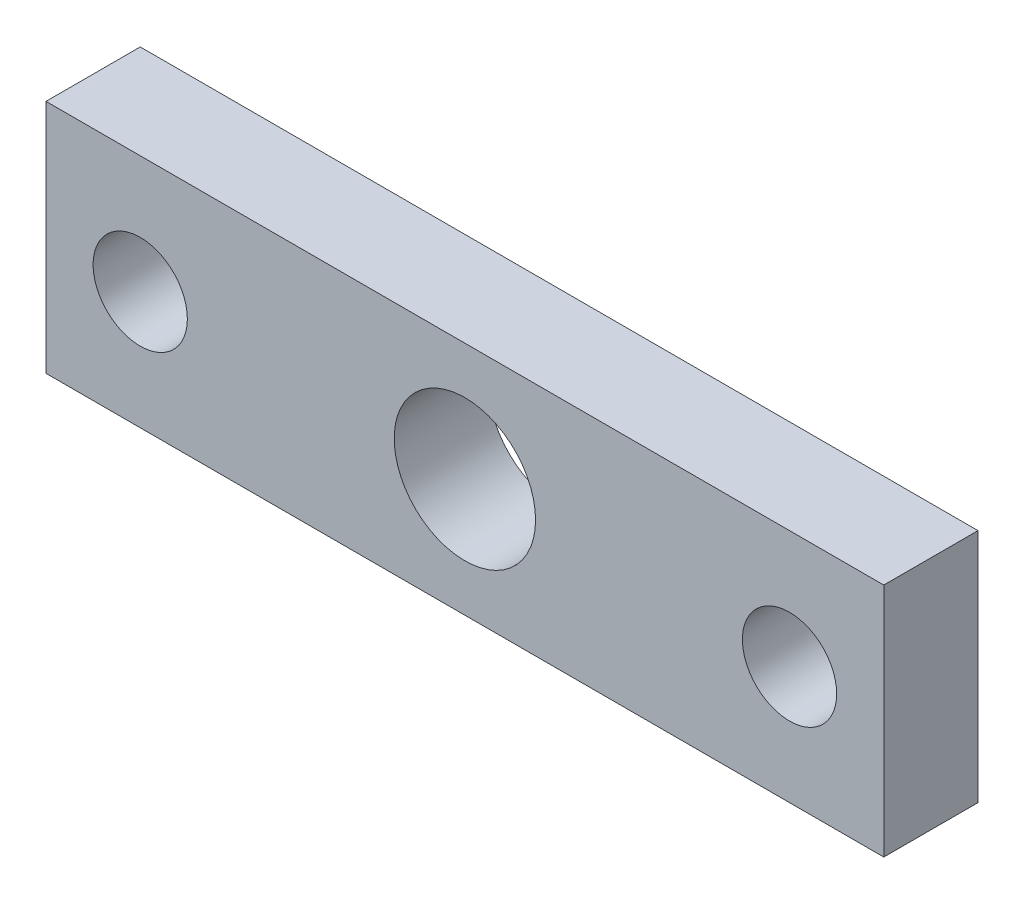
from build123d import *

# Parameters (mm, degrees)
SKETCH1_W           = 88.9
SKETCH1_H           = 25
BOSS_EXTRUDE1_DEPTH = 10
SKETCH2_R           = 5
SKETCH2_R_2         = 7.5
CUT_EXTRUDE1_DEPTH  = 93.888158556


with BuildPart() as part:
    # Sketch1 → Boss-Extrude1 (new body)
    with BuildSketch(Plane.XY):
        with Locations((44.45, 12.5)):
            Rectangle(SKETCH1_W, SKETCH1_H)
    extrude(amount=BOSS_EXTRUDE1_DEPTH)

    # Sketch2 → Cut-Extrude1 (cut, through all)
    with BuildSketch(Plane.XY.offset(10)):
        with Locations((10, 12.5)):
            Circle(SKETCH2_R)
        with Locations((78.9, 12.5)):
            Circle(SKETCH2_R)
        with Locations((44.45, 12.5)):
            Circle(SKETCH2_R_2)
    extrude(amount=-CUT_EXTRUDE1_DEPTH, mode=Mode.SUBTRACT)


solid = part.part
